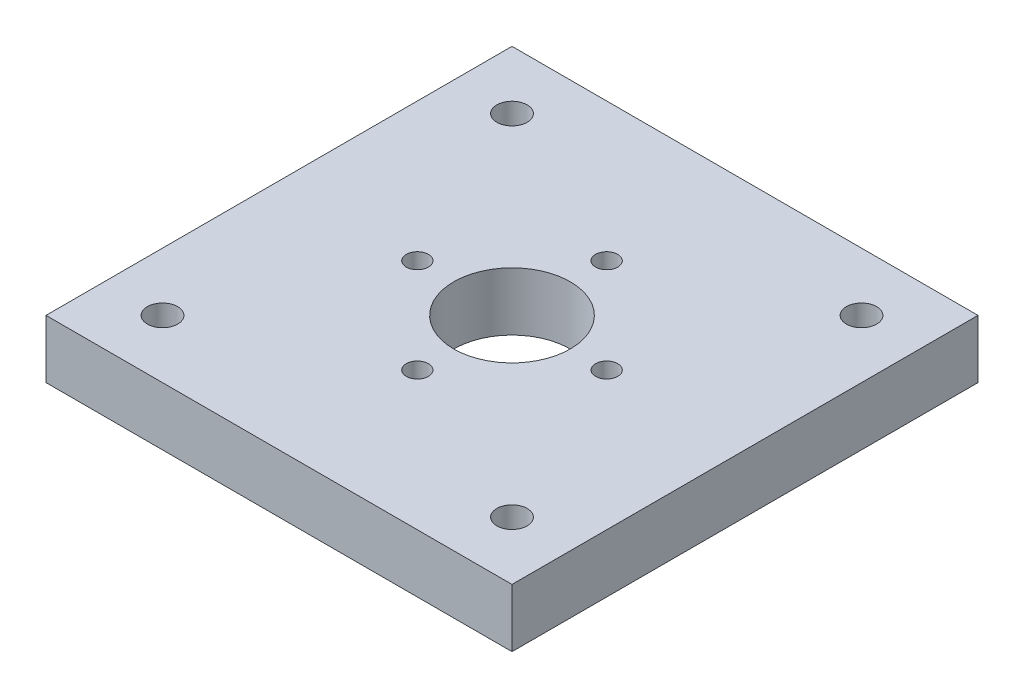
from build123d import *

# Parameters (mm, degrees)
SKETCH1_W           = 4
SKETCH1_H           = 4
SKETCH1_R           = 0.5
SKETCH1_R_2         = 0.13
SKETCH1_R_3         = 0.095
BOSS_EXTRUDE1_DEPTH = 0.5


with BuildPart() as part:
    # Sketch1 → Boss-Extrude1 (new body)
    with BuildSketch(Plane(origin=(0, 0, 0), x_dir=(1, 0, 0), z_dir=(0, 1, 0))):
        Rectangle(SKETCH1_W, SKETCH1_H)
        with Locations(Location((0, 0, 0), (0, 0, 270))):
            Circle(SKETCH1_R, mode=Mode.SUBTRACT)
        with Locations(Location((1.5, 1.5, 0), (0, 0, 270))):
            Circle(SKETCH1_R_2, mode=Mode.SUBTRACT)
        with Locations(Location((0, 0.8125, 0), (0, 0, 270))):
            Circle(SKETCH1_R_3, mode=Mode.SUBTRACT)
        with Locations(Location((0.8125, 0, 0), (0, 0, 270))):
            Circle(SKETCH1_R_3, mode=Mode.SUBTRACT)
        with Locations(Location((0, -0.8125, 0), (0, 0, 270))):
            Circle(SKETCH1_R_3, mode=Mode.SUBTRACT)
        with Locations(Location((-0.8125, 0, 0), (0, 0, 270))):
            Circle(SKETCH1_R_3, mode=Mode.SUBTRACT)
        with Locations(Location((-1.5, 1.5, 0), (0, 0, 90))):
            Circle(SKETCH1_R_2, mode=Mode.SUBTRACT)
        with Locations(Location((1.5, -1.5, 0), (0, 0, 90))):
            Circle(SKETCH1_R_2, mode=Mode.SUBTRACT)
        with Locations(Location((-1.5, -1.5, 0), (0, 0, 270))):
            Circle(SKETCH1_R_2, mode=Mode.SUBTRACT)
    extrude(amount=BOSS_EXTRUDE1_DEPTH)


solid = part.part
